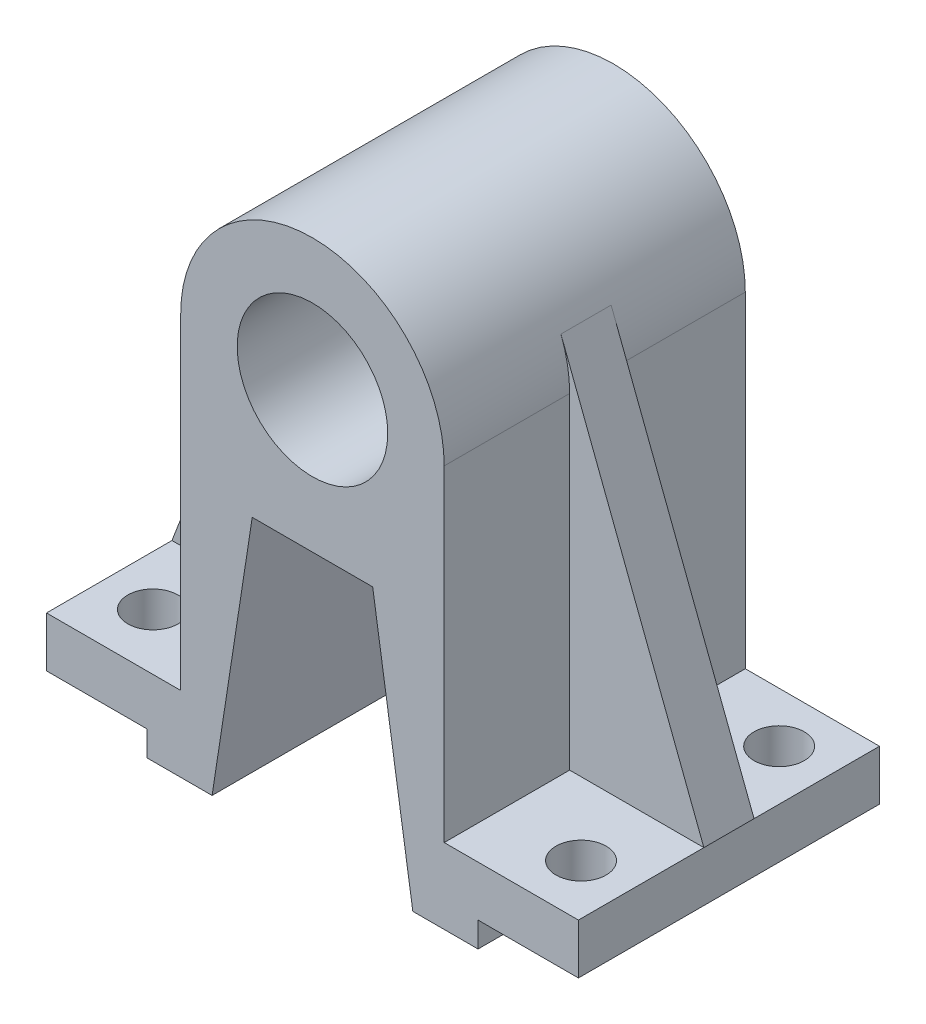
from build123d import *

# Parameters (mm, degrees)
BOSS_EXTRUDE1_DEPTH = 60
SKETCH3_R           = 15
CUT_EXTRUDE1_DEPTH  = 60
SKETCH4_R           = 5
CUT_EXTRUDE2_DEPTH  = 60
BOSS_EXTRUDE2_DEPTH = 5
BOSS_EXTRUDE3_DEPTH = 5


with BuildPart() as part:
    # Sketch2 → Boss-Extrude1 (new body)
    with BuildSketch(Plane.XY):
        with BuildLine():
            ThreePointArc((-1.497772579, 31.002473484), (-20.061398623, 23.31316781), (-27.750704297, 4.749541766))
            Line((-27.750704297, 4.749541766), (-1.497772579, 4.749541766))
            Line((-1.497772579, 4.749541766), (-1.497772579, 31.002473484))
        make_face()
        with BuildLine():
            Line((-1.497772579, 4.749541766), (-27.750704297, 4.749541766))
            ThreePointArc((-27.750704297, 4.749541766), (-20.061398623, -13.814084278), (-1.497772579, -21.503389952))
            Line((-1.497772579, -21.503389952), (-1.497772579, 4.749541766))
        make_face()
        with BuildLine():
            Line((24.75515914, 4.749541766), (-1.497772579, 4.749541766))
            Line((-1.497772579, 4.749541766), (-1.497772579, -21.503389952))
            ThreePointArc((-1.497772579, -21.503389952), (17.065853465, -13.814084278), (24.75515914, 4.749541766))
        make_face()
        with BuildLine():
            Line((-1.497772579, 31.002473484), (-1.497772579, 4.749541766))
            Line((-1.497772579, 4.749541766), (24.75515914, 4.749541766))
            ThreePointArc((24.75515914, 4.749541766), (17.065853465, 23.31316781), (-1.497772579, 31.002473484))
        make_face()
        with BuildLine():
            ThreePointArc((-1.497772579, -21.503389952), (-20.061398623, -13.814084278), (-27.750704297, 4.749541766))
            Line((-27.750704297, 4.749541766), (-27.750704297, -60.250458234))
            Line((-27.750704297, -60.250458234), (-54.497772579, -60.250458234))
            Line((-54.497772579, -60.250458234), (-54.497772579, -70.250458234))
            Line((-54.497772579, -70.250458234), (-34.497772579, -70.250458234))
            Line((-34.497772579, -70.250458234), (-34.497772579, -75.250458234))
            Line((-34.497772579, -75.250458234), (-21.497772579, -75.250458234))
            Line((-21.497772579, -75.250458234), (-13.497772579, -23.250458234))
            Line((-13.497772579, -23.250458234), (10.502227421, -23.250458234))
            Line((10.502227421, -23.250458234), (18.502227421, -75.250458234))
            Line((18.502227421, -75.250458234), (31.502227421, -75.250458234))
            Line((31.502227421, -75.250458234), (31.502227421, -70.250458234))
            Line((31.502227421, -70.250458234), (51.502227421, -70.250458234))
            Line((51.502227421, -70.250458234), (51.502227421, -60.250458234))
            Line((51.502227421, -60.250458234), (24.75515914, -60.250458234))
            Line((24.75515914, -60.250458234), (24.75515914, 4.749541766))
            ThreePointArc((24.75515914, 4.749541766), (17.065853465, -13.814084278), (-1.497772579, -21.503389952))
        make_face()
    extrude(amount=-BOSS_EXTRUDE1_DEPTH)

    # Sketch3 → Cut-Extrude1 (cut)
    with BuildSketch(Plane.XY):
        with Locations((-1.497772579, 4.749541766)):
            Circle(SKETCH3_R)
    extrude(amount=-CUT_EXTRUDE1_DEPTH, mode=Mode.SUBTRACT)

    # Sketch4 → Cut-Extrude2 (cut)
    with BuildSketch(Plane(origin=(0, -60.250458234, 0), x_dir=(1, 0, 0), z_dir=(0, 1, 0))):
        with Locations(Location((41.502227421, 10.524161434, 0), (0, 0, 270))):
            Circle(SKETCH4_R)
        with Locations(Location((41.502227421, 50, 0), (0, 0, 270))):
            Circle(SKETCH4_R)
        with Locations(Location((-44.497772579, 50, 0), (0, 0, 270))):
            Circle(SKETCH4_R)
        with Locations(Location((-44.497772579, 11.209528187, 0), (0, 0, 270))):
            Circle(SKETCH4_R)
    extrude(amount=-CUT_EXTRUDE2_DEPTH, mode=Mode.SUBTRACT)


with BuildPart() as part_1:
    # Body-Move/Copy1: moved
    add(part.part.moved(Location((0, 0, 30))))

    # Sketch5 → Boss-Extrude2 (add, symmetric)
    with BuildSketch(Plane.XY):
        Polygon((23.019364547, 14.137108595), (51.502227421, -60.250458234), (24.75515914, -60.250458234), (23.019364547, -60.250458234), align=None)
    extrude(amount=BOSS_EXTRUDE2_DEPTH, both=True)

    # Sketch7 → Boss-Extrude3 (add, symmetric)
    with BuildSketch(Plane.XY):
        Polygon((-54.497772579, -60.250458234), (-26.888977339, 11.420609494), (-26.888977339, -60.250458234), align=None)
    extrude(amount=BOSS_EXTRUDE3_DEPTH, both=True)


solid = part_1.part
